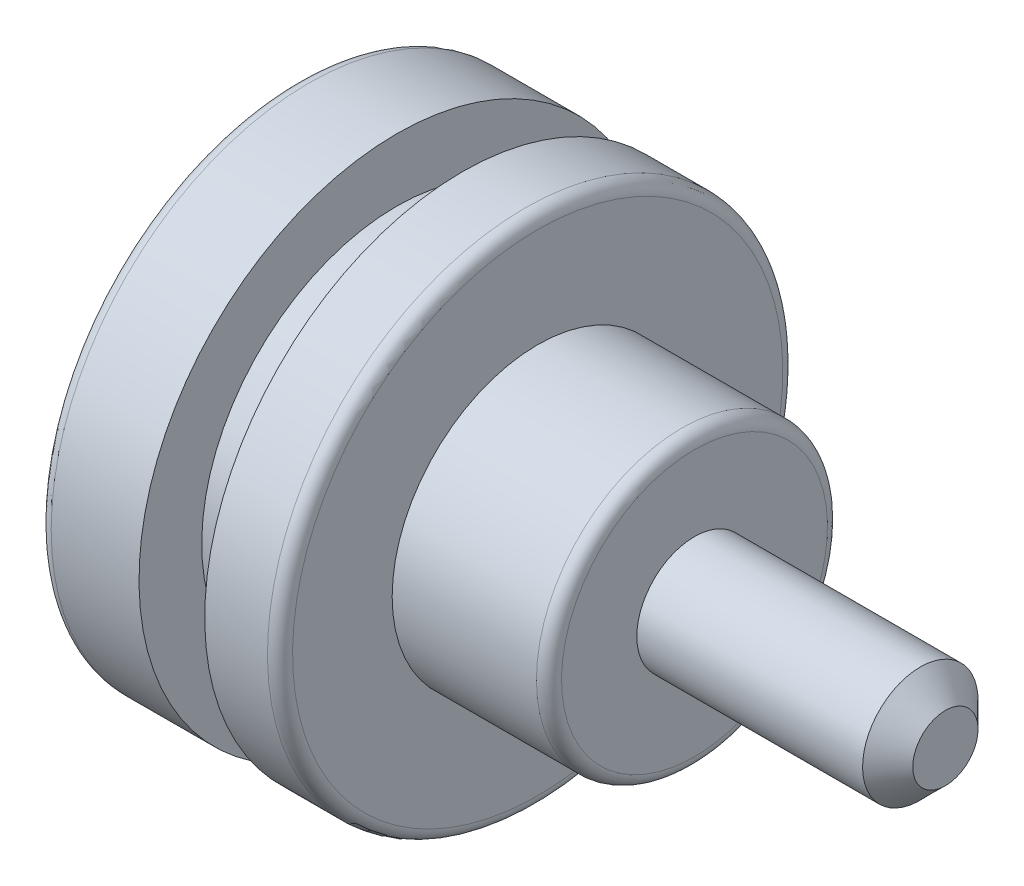
from build123d import *

# Parameters (mm, degrees)
FILETE2_R             = 0.5
FILETE3_R             = 0.5
FILETE4_R             = 0.5
FILETE5_R             = 0.5
ESBO_O5_R             = 1
CORTE_EXTRUS_O1_DEPTH = 3
CHANFRO1_SIZE         = 1


with BuildPart() as part:
    # Esboço1 → Revolução1 (revolve)
    with BuildSketch(Plane.XY):
        Polygon((0, 5), (0, 10.27), (4, 10.27), (4, 7.77), (6.62, 7.77), (6.62, 10.27), (9.62, 10.27), (9.62, 5.8), (15.87, 5.8), (15.87, 2.3), (24.87, 2.3), (25.87, 1.3), (25.87, 0), (9.386751346, 0), (6.5, 5), align=None)
    revolve(axis=Axis((25.87, 0, 0), (-1, 0, 0)))

    # Filete2
    filete2_edges = [part.edges().sort_by_distance(p)[0] for p in [
        (0, -5, 0),
    ]]
    fillet(filete2_edges, radius=FILETE2_R)

    # Filete3
    filete3_edges = [part.edges().sort_by_distance(p)[0] for p in [
        (0, -10.27, 0),
    ]]
    fillet(filete3_edges, radius=FILETE3_R)

    # Filete4
    filete4_edges = [part.edges().sort_by_distance(p)[0] for p in [
        (9.62, -10.27, 0),
    ]]
    fillet(filete4_edges, radius=FILETE4_R)

    # Filete5
    filete5_edges = [part.edges().sort_by_distance(p)[0] for p in [
        (15.87, -5.8, 0),
    ]]
    fillet(filete5_edges, radius=FILETE5_R)

    # Esboço5 → Corte-extrusão1 (cut)
    with BuildSketch(Plane(origin=(0, 0, -10.27), x_dir=(-1, 0, 0), z_dir=(0, 0, -1))):
        with Locations((-2, 0)):
            Circle(ESBO_O5_R)
    extrude(amount=-CORTE_EXTRUS_O1_DEPTH, mode=Mode.SUBTRACT)

    # Chanfro1
    chanfro1_edges = [part.edges().sort_by_distance(p)[0] for p in [
        (3, 0, -7.27),
    ]]
    chamfer(chanfro1_edges, length=CHANFRO1_SIZE)


solid = part.part
